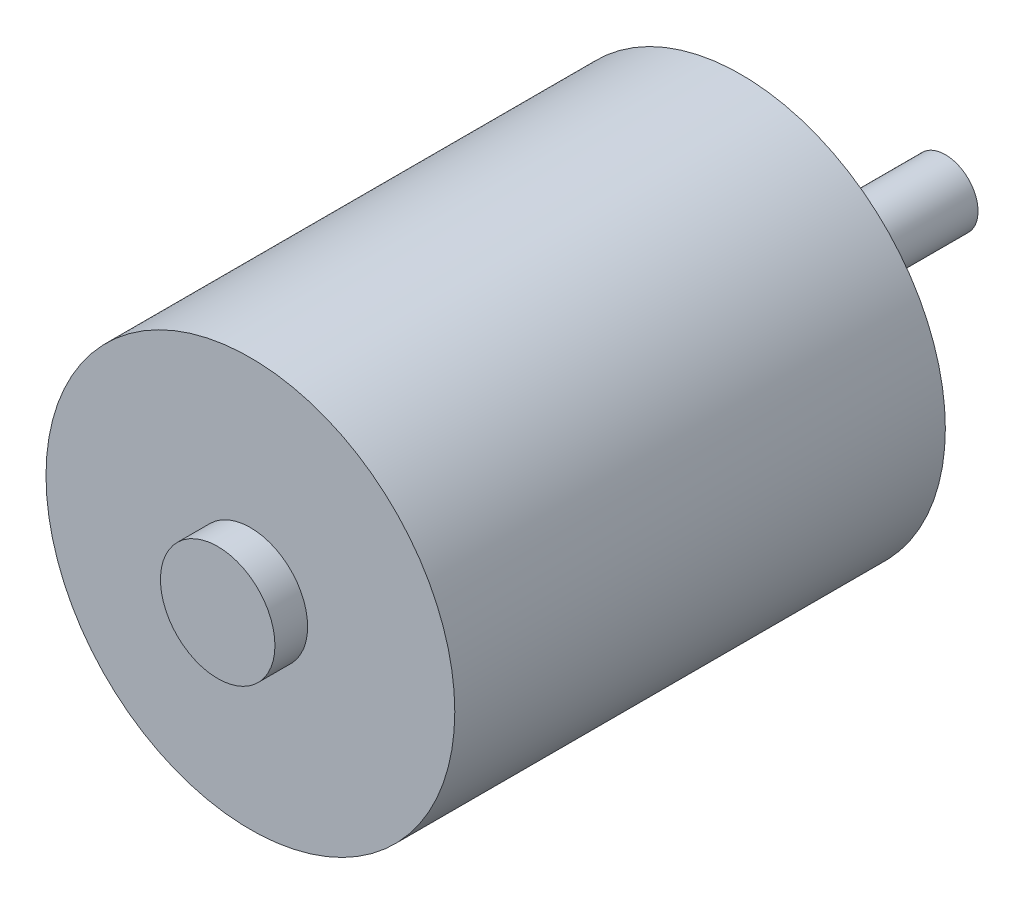
from build123d import *

# Parameters (mm, degrees)
SKETCH1_R           = 25
BOSS_EXTRUDE1_DEPTH = 7
SKETCH2_R           = 4
BOSS_EXTRUDE3_DEPTH = 25
SKETCH3_R           = 25
BOSS_EXTRUDE4_DEPTH = 53
SKETCH4_R           = 7
BOSS_EXTRUDE5_DEPTH = 4


with BuildPart() as part:
    # Sketch1 → Boss-Extrude1 (new body)
    with BuildSketch(Plane.XY):
        Circle(SKETCH1_R)
    extrude(amount=BOSS_EXTRUDE1_DEPTH)

    # Sketch2 → Boss-Extrude3 (add)
    with BuildSketch(Plane(origin=(0, 0, 0), x_dir=(-1, 0, 0), z_dir=(0, 0, -1))):
        Circle(SKETCH2_R)
    extrude(amount=BOSS_EXTRUDE3_DEPTH)

    # Sketch3 → Boss-Extrude4 (add)
    with BuildSketch(Plane.XY.offset(7)):
        Circle(SKETCH3_R)
    extrude(amount=BOSS_EXTRUDE4_DEPTH)

    # Sketch4 → Boss-Extrude5 (add)
    with BuildSketch(Plane.XY.offset(60)):
        Circle(SKETCH4_R)
    extrude(amount=BOSS_EXTRUDE5_DEPTH)


solid = part.part
